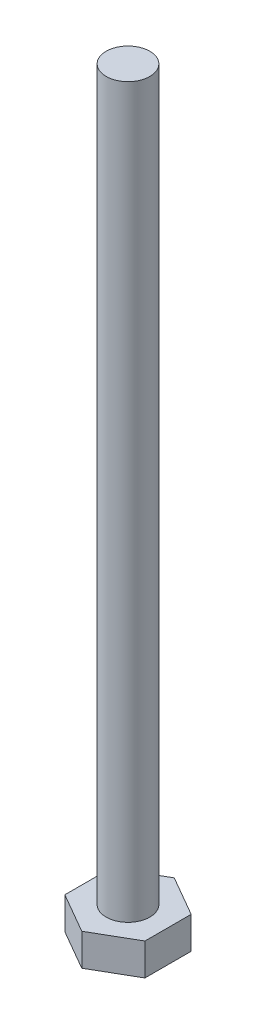
from build123d import *

# Parameters (mm, degrees)
SKETCH_1_R      = 1.5
EXTRUDE_3_DEPTH = 50
EXTRUDE_4_DEPTH = 2.2


with BuildPart() as part:
    # 草图1 → 凸台-拉伸3 (new body)
    with BuildSketch(Plane(origin=(0, 0, 0), x_dir=(1, 0, 0), z_dir=(0, 1, 0))):
        Circle(SKETCH_1_R)
    extrude(amount=EXTRUDE_3_DEPTH)

    # 草图1<4> → 凸台-拉伸4 (add)
    with BuildSketch(Plane(origin=(0, 0, 0), x_dir=(1, 0, 0), z_dir=(0, 1, 0))):
        Polygon((-2.75, -1.58771324), (0, -3.175426481), (2.75, -1.58771324), (2.75, 1.58771324), (0, 3.175426481), (-2.75, 1.58771324), align=None)
    extrude(amount=-EXTRUDE_4_DEPTH)


solid = part.part
